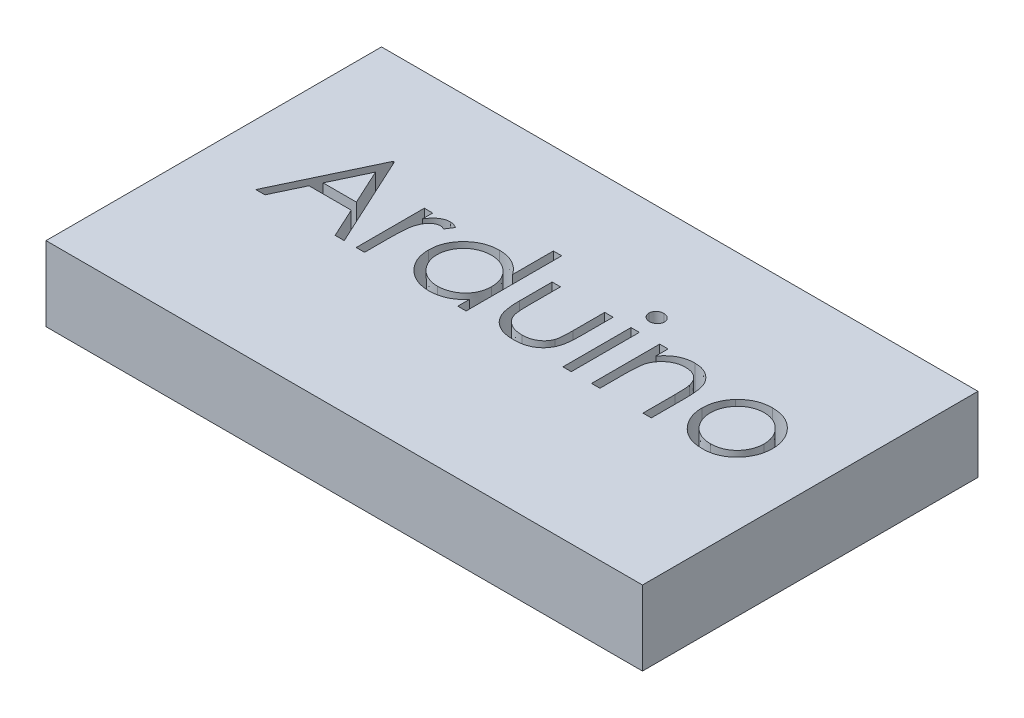
from build123d import *

# Parameters (mm, degrees)
SKETCH1_W           = 101.6
SKETCH1_H           = 57.15
BOSS_EXTRUDE1_DEPTH = 12.7
SKETCH2_W           = 1.424679487
SKETCH2_H           = 11.600961538
CUT_EXTRUDE1_DEPTH  = 118.260276735


with BuildPart() as part:
    # Sketch1 → Boss-Extrude1 (new body)
    with BuildSketch(Plane(origin=(0, 0, 0), x_dir=(1, 0, 0), z_dir=(0, 1, 0))):
        with Locations((50.8, 28.575)):
            Rectangle(SKETCH1_W, SKETCH1_H)
    extrude(amount=BOSS_EXTRUDE1_DEPTH)

    # Sketch2 → Cut-Extrude1 (cut, through all)
    # profile 1 of 8: a face of its own
    with BuildSketch(Plane(origin=(0, 12.7, 0), x_dir=(1, 0, 0), z_dir=(0, 1, 0))):
        Polygon((18.073076923, 41.275), (25.4, 25.4), (23.851297075, 25.4), (21.504392027, 30.488141026), (14.307852564, 30.488141026), (11.894165665, 25.4), (10.339102564, 25.4), (17.869551282, 41.275), align=None)
        Polygon((17.955413662, 38.180774239), (15.080613982, 32.116346154), (20.753891226, 32.116346154), align=None, mode=Mode.SUBTRACT)
    # profile 2 of 8: a face of its own
    with BuildSketch(Plane(origin=(0, 12.7, 0), x_dir=(1, 0, 0), z_dir=(0, 1, 0))):
        with BuildLine():
            Line((27.43525641, 37.000961538), (28.859935897, 37.000961538))
            Line((28.859935897, 37.000961538), (28.859935897, 35.293254207))
            add(Edge.make_bspline(
                [(28.859935897, 35.293254207), (28.965113482, 35.452257428), (29.166264795, 35.756349853), (29.500605581, 36.158528469), (29.84306712, 36.491518144), (30.195288862, 36.75687339), (30.559860958, 36.955597179), (30.928782132, 37.101162017), (31.307856584, 37.187237696), (31.562591027, 37.19872965), (31.690214343, 37.204487179)],
                knots=[0, 0, 0, 0, 1.2804753, 2.448899062, 3.506932113, 4.484331642, 5.4025378, 6.288909075, 7.142734305, 8, 8, 8, 8], degree=3))
            add(Edge.make_bspline(
                [(31.690214343, 37.204487179), (31.789212324, 37.199087291), (31.992907103, 37.18797667), (32.301256707, 37.109913286), (32.618953792, 36.985280827), (32.823706763, 36.86807696), (32.930448718, 36.806976162)],
                knots=[0, 0, 0, 0, 0.901110191, 1.854092781, 2.881294221, 4, 4, 4, 4], degree=3))
            Line((32.930448718, 36.806976162), (32.148147035, 35.573101963))
            add(Edge.make_bspline(
                [(32.148147035, 35.573101963), (32.079616832, 35.603673884), (31.949533388, 35.661705244), (31.759239462, 35.730385075), (31.583791971, 35.770825122), (31.472015831, 35.776951591), (31.419906851, 35.779807692)],
                knots=[0, 0, 0, 0, 1.180555205, 2.24091978, 3.179933427, 4, 4, 4, 4], degree=3))
            add(Edge.make_bspline(
                [(31.419906851, 35.779807692), (31.305580845, 35.772187523), (31.072388934, 35.756644586), (30.730012811, 35.634457851), (30.397784415, 35.437039797), (30.133934375, 35.218095826), (29.929635585, 35.006968316), (29.783856705, 34.822598776), (29.650131389, 34.615867125), (29.522359318, 34.390307488), (29.40594434, 34.142068544), (29.297292805, 33.873630397), (29.199054391, 33.584682134), (29.143037212, 33.383375703), (29.114342949, 33.280258413)],
                knots=[0, 0, 0, 0, 1.125678352, 2.296057538, 3.5422874, 4.923748041, 5.663163013, 6.437101912, 7.23742474, 8.08941207, 8.991984279, 9.93940061, 10.944477711, 12, 12, 12, 12], degree=3))
            add(Edge.make_bspline(
                [(29.114342949, 33.280258413), (29.092878165, 33.188286948), (29.045335299, 32.984577139), (28.999109395, 32.642817759), (28.953436938, 32.239031879), (28.921248705, 31.772095547), (28.891412585, 31.243174819), (28.874584712, 30.651463923), (28.860509754, 29.996355509), (28.860132986, 29.538364692), (28.859935897, 29.298788061)],
                knots=[0, 0, 0, 0, 0.566838948, 1.255505196, 2.06880316, 3.007127437, 4.065329342, 5.249902469, 6.561414163, 8, 8, 8, 8], degree=3))
            Line((28.859935897, 29.298788061), (28.859935897, 25.4))
            Line((28.859935897, 25.4), (27.43525641, 25.4))
            Line((27.43525641, 25.4), (27.43525641, 37.000961538))
        make_face()
    # profile 3 of 8: a face of its own
    with BuildSketch(Plane(origin=(0, 12.7, 0), x_dir=(1, 0, 0), z_dir=(0, 1, 0))):
        with BuildLine():
            Line((46.159615385, 41.682051282), (46.159615385, 25.4))
            Line((46.159615385, 25.4), (44.734935897, 25.4))
            Line((44.734935897, 25.4), (44.734935897, 27.406635617))
            add(Edge.make_bspline(
                [(44.734935897, 27.406635617), (44.574286383, 27.225027459), (44.260776835, 26.870616854), (43.737168907, 26.407601286), (43.182141814, 26.024885328), (42.598389394, 25.715776781), (41.98643879, 25.48358424), (41.347646537, 25.318547018), (40.681752059, 25.212439266), (40.227036021, 25.201843738), (39.996604567, 25.196474359)],
                knots=[0, 0, 0, 0, 1.074387032, 2.096679803, 3.090159297, 4.057316773, 5.018401886, 5.985159533, 6.978961417, 8, 8, 8, 8], degree=3))
            add(Edge.make_bspline(
                [(39.996604567, 25.196474359), (39.791735634, 25.202036833), (39.387725026, 25.213006279), (38.793414569, 25.298106727), (38.221496152, 25.434770618), (37.67142934, 25.624821081), (37.146773538, 25.876919808), (36.643036671, 26.178731897), (36.162828389, 26.538145662), (35.713468194, 26.949027077), (35.299665907, 27.395318626), (34.936530849, 27.871321642), (34.633757951, 28.374977806), (34.380574013, 28.899910325), (34.18555488, 29.450160139), (34.049603039, 30.023824436), (33.964601727, 30.620224934), (33.953636816, 31.026350628), (33.948076923, 31.232281651)],
                knots=[0, 0, 0, 0, 1.033919861, 2.038935746, 3.024066025, 3.998881131, 4.97069526, 5.957263378, 6.95902576, 7.993208707, 9.027059324, 10.027763471, 11.009749337, 11.988697705, 12.965288445, 13.950418724, 14.960734635, 16, 16, 16, 16], degree=3))
            add(Edge.make_bspline(
                [(33.948076923, 31.232281651), (33.953760043, 31.433956306), (33.964995265, 31.83265622), (34.048693798, 32.419027458), (34.189441587, 32.983806712), (34.386962182, 33.525175704), (34.640245335, 34.043789503), (34.94834773, 34.540014902), (35.311291617, 35.015218955), (35.729722177, 35.458227734), (36.182997742, 35.867442663), (36.6679052, 36.22308369), (37.172382226, 36.530227969), (37.704253738, 36.773584808), (38.255647392, 36.970476104), (38.831471949, 37.106697066), (39.42933161, 37.186967059), (39.835234913, 37.198591025), (40.041125801, 37.204487179)],
                knots=[0, 0, 0, 0, 1.020392517, 2.01726096, 2.990465484, 3.961182959, 4.928053699, 5.906110375, 6.912531644, 7.948652711, 8.985773172, 9.998621852, 10.987621588, 11.969261332, 12.953316658, 13.946091881, 14.958173133, 16, 16, 16, 16], degree=3))
            add(Edge.make_bspline(
                [(40.041125801, 37.204487179), (40.277966322, 37.19737928), (40.742857944, 37.183427262), (41.422754809, 37.066830526), (42.0658629, 36.871056045), (42.675884665, 36.603034876), (43.249183349, 36.254688611), (43.789961325, 35.833994544), (44.288814254, 35.329046417), (44.583961449, 34.949808209), (44.734935897, 34.755819311)],
                knots=[0, 0, 0, 0, 1.031072012, 2.023879775, 2.993683497, 3.952812103, 4.918022106, 5.908088563, 6.929940113, 8, 8, 8, 8], degree=3))
            Line((44.734935897, 34.755819311), (44.734935897, 41.682051282))
            Line((44.734935897, 41.682051282), (46.159615385, 41.682051282))
        make_face()
        with BuildLine():
            add(Edge.make_bspline(
                [(40.06020633, 35.779807692), (39.851952012, 35.772397978), (39.440891112, 35.757772381), (38.837441531, 35.6435926), (38.25998426, 35.453616047), (37.711407423, 35.193801709), (37.200376584, 34.86709994), (36.743658862, 34.471942237), (36.337518753, 34.019110065), (35.995941983, 33.510646922), (35.717492229, 32.965553437), (35.521698905, 32.395756879), (35.392570533, 31.811534302), (35.379378315, 31.41528212), (35.37275641, 31.21638121)],
                knots=[0, 0, 0, 0, 1.031046209, 2.035121221, 3.029706178, 4.034933723, 5.034054252, 6.02443088, 7.017295772, 8.038157696, 9.050218397, 10.03989886, 11.016116709, 12, 12, 12, 12], degree=3))
            add(Edge.make_bspline(
                [(35.37275641, 31.21638121), (35.381215033, 31.018668938), (35.398099125, 30.62401936), (35.519432632, 30.039000315), (35.722994915, 29.469069481), (36.000771414, 28.919064261), (36.348600033, 28.408414948), (36.751773564, 27.946950821), (37.214190912, 27.550123046), (37.726397819, 27.217938337), (38.273441113, 26.949594046), (38.848723588, 26.762878466), (39.441430947, 26.642329247), (39.844439747, 26.628248227), (40.047485978, 26.621153846)],
                knots=[0, 0, 0, 0, 0.979072187, 1.954306742, 2.945804271, 3.96968567, 4.997920485, 5.998718438, 6.996577872, 8.005894225, 9.015743152, 10.005417472, 10.995077863, 12, 12, 12, 12], degree=3))
            add(Edge.make_bspline(
                [(40.047485978, 26.621153846), (40.253618329, 26.628682968), (40.663595133, 26.643657645), (41.268834986, 26.758326241), (41.856187139, 26.947777577), (42.417650639, 27.210391473), (42.940691662, 27.535862337), (43.410128464, 27.9168945), (43.807075892, 28.360048228), (44.143592372, 28.84707714), (44.40745944, 29.380985124), (44.599665137, 29.949465204), (44.713302496, 30.552537168), (44.727625055, 30.96466998), (44.734935897, 31.175040064)],
                knots=[0, 0, 0, 0, 1.01762866, 2.023962475, 3.030623092, 4.058876274, 5.077231937, 6.066672613, 7.034107872, 8.005628644, 8.981990164, 9.965428785, 10.961468474, 12, 12, 12, 12], degree=3))
            add(Edge.make_bspline(
                [(44.734935897, 31.175040064), (44.73058317, 31.335322367), (44.722015626, 31.650808661), (44.656562686, 32.114029901), (44.552445698, 32.557322159), (44.405732712, 32.981151498), (44.213004387, 33.383174604), (43.980559163, 33.766278088), (43.704309444, 34.128469439), (43.388702216, 34.464761226), (43.043238618, 34.771495537), (42.677684809, 35.045290485), (42.287709778, 35.27021099), (41.879871789, 35.456362472), (41.453463237, 35.604495045), (41.005014354, 35.703317798), (40.539291806, 35.77117354), (40.221582912, 35.776899339), (40.06020633, 35.779807692)],
                knots=[0, 0, 0, 0, 1.050140795, 2.067009409, 3.05949893, 4.030605086, 5.00011959, 5.97591094, 6.962425594, 7.979863591, 8.993523472, 9.986985069, 10.967611495, 11.937549037, 12.921786183, 13.919465291, 14.943216303, 16, 16, 16, 16], degree=3))
        make_face(mode=Mode.SUBTRACT)
    # profile 4 of 8: a face of its own
    with BuildSketch(Plane(origin=(0, 12.7, 0), x_dir=(1, 0, 0), z_dir=(0, 1, 0))):
        with BuildLine():
            Line((49.2125, 37.000961538), (50.637179487, 37.000961538))
            Line((50.637179487, 37.000961538), (50.637179487, 31.620252404))
            add(Edge.make_bspline(
                [(50.637179487, 31.620252404), (50.637823127, 31.462306363), (50.639054381, 31.160162985), (50.647404363, 30.725391245), (50.66704443, 30.328894013), (50.691599991, 29.970442242), (50.723178252, 29.650096573), (50.760749208, 29.368975918), (50.802742763, 29.123892298), (50.843848645, 28.976284934), (50.862965745, 28.90763722)],
                knots=[0, 0, 0, 0, 1.388932606, 2.656963016, 3.823490214, 4.879454478, 5.816252168, 6.653371382, 7.373723809, 8, 8, 8, 8], degree=3))
            add(Edge.make_bspline(
                [(50.862965745, 28.90763722), (50.893633773, 28.821354912), (50.954332249, 28.650584085), (51.064429836, 28.403891097), (51.200629791, 28.175403209), (51.349672582, 27.956309736), (51.521573466, 27.753100724), (51.714157496, 27.566119333), (51.920978071, 27.388300777), (52.228295498, 27.177912613), (52.648571455, 26.95241808), (53.200353595, 26.757854904), (53.798633477, 26.641578149), (54.212130596, 26.628087778), (54.424664463, 26.621153846)],
                knots=[0, 0, 0, 0, 0.725840625, 1.436591201, 2.137033971, 2.831655856, 3.53531722, 4.242432219, 4.957935707, 5.694543706, 7.190802206, 8.724350549, 10.316345118, 12, 12, 12, 12], degree=3))
            add(Edge.make_bspline(
                [(54.424664463, 26.621153846), (54.637178587, 26.628235224), (55.048354097, 26.641936379), (55.640060565, 26.754347429), (56.180950909, 26.942151804), (56.665596295, 27.204349708), (57.091798499, 27.525215493), (57.44696497, 27.901719732), (57.740005017, 28.32195088), (57.867954889, 28.635478859), (57.932301683, 28.793154046)],
                knots=[0, 0, 0, 0, 1.157059328, 2.238695713, 3.266970494, 4.264342957, 5.228770407, 6.160125903, 7.074715775, 8, 8, 8, 8], degree=3))
            add(Edge.make_bspline(
                [(57.932301683, 28.793154046), (57.951325512, 28.856501187), (57.993382552, 28.996546243), (58.038568932, 29.234125816), (58.079274526, 29.517447415), (58.114032504, 29.848365005), (58.13882092, 30.226013803), (58.152183255, 30.650275792), (58.16727936, 31.119819104), (58.167508487, 31.448512155), (58.167628205, 31.620252404)],
                knots=[0, 0, 0, 0, 0.557542046, 1.232589297, 2.036731608, 2.971723315, 4.038036528, 5.22795436, 6.551621927, 8, 8, 8, 8], degree=3))
            Line((58.167628205, 31.620252404), (58.167628205, 37.000961538))
            Line((58.167628205, 37.000961538), (59.592307692, 37.000961538))
            Line((59.592307692, 37.000961538), (59.592307692, 31.353125))
            add(Edge.make_bspline(
                [(59.592307692, 31.353125), (59.590304291, 31.161231758), (59.586417418, 30.788932619), (59.561437681, 30.247893971), (59.518576938, 29.743693789), (59.453522617, 29.276065184), (59.377024736, 28.845365178), (59.278344498, 28.451041762), (59.160514634, 28.094309857), (59.027593191, 27.768909654), (58.870558292, 27.473875527), (58.703521448, 27.193859502), (58.510641233, 26.935809403), (58.307576242, 26.686879709), (58.08169016, 26.459452067), (57.8372158, 26.248307873), (57.577594146, 26.050219479), (57.297063855, 25.872912604), (56.999720284, 25.713179963), (56.685196361, 25.571592752), (56.34963969, 25.45954892), (55.997379623, 25.362889829), (55.626690302, 25.287077772), (55.237929091, 25.233617273), (54.831226939, 25.200845237), (54.55405189, 25.197955783), (54.411944111, 25.196474359)],
                knots=[0, 0, 0, 0, 1.493040784, 2.896703357, 4.213163133, 5.428574705, 6.569057535, 7.615249723, 8.588095153, 9.490268104, 10.346124644, 11.18633936, 12.024365274, 12.850166724, 13.684164916, 14.514361689, 15.362232829, 16.222528818, 17.093394965, 17.986930858, 18.902426812, 19.842810585, 20.827885679, 21.843828298, 22.894529745, 24, 24, 24, 24], degree=3))
            add(Edge.make_bspline(
                [(54.411944111, 25.196474359), (54.270899207, 25.198015174), (53.993732842, 25.201043018), (53.587009699, 25.233436217), (53.197171377, 25.286994705), (52.825603855, 25.363445155), (52.471934268, 25.458872365), (52.134730037, 25.572281258), (51.81793959, 25.713253444), (51.517756929, 25.871901651), (51.236531811, 26.051358436), (50.972967903, 26.248063472), (50.727418608, 26.461723116), (50.499829764, 26.691445057), (50.293395906, 26.940079018), (50.105544574, 27.205624952), (49.933383804, 27.485451711), (49.777569362, 27.785095341), (49.643712471, 28.114261243), (49.52553332, 28.478465933), (49.428874353, 28.881702349), (49.350213871, 29.323625738), (49.286934123, 29.802121106), (49.243000549, 30.319956418), (49.218435888, 30.875870307), (49.214521288, 31.259818023), (49.2125, 31.458067909)],
                knots=[0, 0, 0, 0, 1.083640291, 2.129454052, 3.13281866, 4.105697902, 5.042300162, 5.946461698, 6.836384745, 7.703652036, 8.553297018, 9.397182691, 10.228592656, 11.052265423, 11.879314572, 12.708807002, 13.549817954, 14.402308542, 15.300838682, 16.27712199, 17.341985831, 18.484375296, 19.725102775, 21.0496083, 22.476576903, 24, 24, 24, 24], degree=3))
            Line((49.2125, 31.458067909), (49.2125, 37.000961538))
        make_face()
    # profile 5 of 8: a face of its own
    with BuildSketch(Plane(origin=(0, 12.7, 0), x_dir=(1, 0, 0), z_dir=(0, 1, 0))):
        with BuildLine():
            add(Edge.make_bspline(
                [(63.351171875, 41.885576923), (63.439578914, 41.881475946), (63.612696877, 41.873445446), (63.86303777, 41.804677317), (64.090989218, 41.688110887), (64.293181078, 41.531720906), (64.466680706, 41.347800216), (64.588150357, 41.133437967), (64.666220868, 40.901850569), (64.675648601, 40.740310701), (64.680448718, 40.658062901)],
                knots=[0, 0, 0, 0, 1.055194115, 2.066272739, 3.074728998, 4.095836921, 5.109056067, 6.073838105, 7.019297344, 8, 8, 8, 8], degree=3))
            add(Edge.make_bspline(
                [(64.680448718, 40.658062901), (64.67554035, 40.577950152), (64.665837088, 40.41957673), (64.588210659, 40.192004196), (64.465645509, 39.980620482), (64.293292332, 39.797056903), (64.090959737, 39.640753377), (63.863045602, 39.524164025), (63.612694817, 39.455401974), (63.439578218, 39.447370636), (63.351171875, 39.443269231)],
                knots=[0, 0, 0, 0, 0.96129708, 1.900370562, 2.859976407, 3.87933698, 4.906634145, 5.921202961, 6.938410037, 8, 8, 8, 8], degree=3))
            add(Edge.make_bspline(
                [(63.351171875, 39.443269231), (63.263776484, 39.447214033), (63.093672774, 39.454892076), (62.847080311, 39.525513228), (62.621072519, 39.640793273), (62.418486326, 39.79603347), (62.249620807, 39.981747825), (62.126710545, 40.191875194), (62.049263397, 40.419609574), (62.039535974, 40.577961185), (62.034615385, 40.658062901)],
                knots=[0, 0, 0, 0, 1.054934014, 2.053291228, 3.073705704, 4.106921865, 5.123545215, 6.088680038, 7.033164197, 8, 8, 8, 8], degree=3))
            add(Edge.make_bspline(
                [(62.034615385, 40.658062901), (62.03942817, 40.740299254), (62.048880785, 40.901816641), (62.126768598, 41.133569112), (62.248597011, 41.346663781), (62.418598139, 41.532743725), (62.621042762, 41.688071233), (62.847087999, 41.803328184), (63.093670743, 41.873955331), (63.263775795, 41.881632546), (63.351171875, 41.885576923)],
                knots=[0, 0, 0, 0, 0.98631895, 1.937192651, 2.907499808, 3.917963147, 4.944918757, 5.95915025, 6.951458133, 8, 8, 8, 8], degree=3))
        make_face()
    # profile 6 of 8: a face of its own
    with BuildSketch(Plane(origin=(0, 12.7, 0), x_dir=(1, 0, 0), z_dir=(0, 1, 0))):
        with Locations((63.357532052, 31.200480769)):
            Rectangle(SKETCH2_W, SKETCH2_H)
    # profile 7 of 8: a face of its own
    with BuildSketch(Plane(origin=(0, 12.7, 0), x_dir=(1, 0, 0), z_dir=(0, 1, 0))):
        with BuildLine():
            Line((67.529807692, 37.000961538), (68.954487179, 37.000961538))
            Line((68.954487179, 37.000961538), (68.954487179, 34.908463542))
            add(Edge.make_bspline(
                [(68.954487179, 34.908463542), (69.10660431, 35.098250177), (69.40179291, 35.466537765), (69.893393278, 35.9505918), (70.412931683, 36.349486214), (70.957226485, 36.667456993), (71.527016567, 36.90715419), (72.11882872, 37.080263949), (72.736206136, 37.184062993), (73.156051975, 37.197625823), (73.368449519, 37.204487179)],
                knots=[0, 0, 0, 0, 1.12780773, 2.188550248, 3.19190651, 4.159438251, 5.104880172, 6.052711206, 7.014878035, 8, 8, 8, 8], degree=3))
            add(Edge.make_bspline(
                [(73.368449519, 37.204487179), (73.583127753, 37.196571472), (74.003304838, 37.181078522), (74.615073188, 37.05853853), (75.18645251, 36.849236837), (75.715405495, 36.562524946), (76.192232498, 36.205988442), (76.610991646, 35.790617789), (76.957353518, 35.312843412), (77.189570129, 34.869599096), (77.342540031, 34.476403493), (77.438843847, 34.139641448), (77.520627228, 33.764455548), (77.59152837, 33.351979555), (77.639503128, 32.899323478), (77.677341379, 32.408342874), (77.704459028, 31.879196783), (77.705534931, 31.513225294), (77.706089744, 31.324504207)],
                knots=[0, 0, 0, 0, 1.235846778, 2.418850247, 3.575807741, 4.728682307, 5.871620074, 6.994088408, 8.11269785, 9.256955736, 9.865816715, 10.540099792, 11.271859618, 12.076849838, 12.949306005, 13.892391288, 14.913166135, 16, 16, 16, 16], degree=3))
            Line((77.706089744, 31.324504207), (77.706089744, 25.4))
            Line((77.706089744, 25.4), (76.281410256, 25.4))
            Line((76.281410256, 25.4), (76.281410256, 30.85703125))
            add(Edge.make_bspline(
                [(76.281410256, 30.85703125), (76.28053392, 31.014975911), (76.278857638, 31.317097167), (76.273570597, 31.749663808), (76.260826117, 32.141942217), (76.242917698, 32.492994562), (76.216705667, 32.802483749), (76.189388732, 33.071040112), (76.155983301, 33.298322679), (76.126215802, 33.435142874), (76.112865585, 33.496504407)],
                knots=[0, 0, 0, 0, 1.430800155, 2.736877192, 3.918605307, 4.986035426, 5.920637409, 6.731861385, 7.431261377, 8, 8, 8, 8], degree=3))
            add(Edge.make_bspline(
                [(76.112865585, 33.496504407), (76.06467121, 33.676622996), (75.971911949, 34.023295552), (75.74270424, 34.493532794), (75.453261348, 34.893574575), (75.09993896, 35.220947562), (74.686149939, 35.475722429), (74.213042541, 35.652497152), (73.685182278, 35.763060944), (73.313914185, 35.774069722), (73.120402644, 35.779807692)],
                knots=[0, 0, 0, 0, 1.084156227, 2.086665306, 3.027808233, 3.945421172, 4.874247719, 5.839848303, 6.874090471, 8, 8, 8, 8], degree=3))
            add(Edge.make_bspline(
                [(73.120402644, 35.779807692), (73.005795651, 35.777648671), (72.778991372, 35.773376024), (72.442668285, 35.730507637), (72.116440785, 35.660392499), (71.797034837, 35.565738321), (71.490838773, 35.435734458), (71.188015023, 35.288190528), (70.899966486, 35.104275424), (70.620551078, 34.899303677), (70.360596557, 34.672158701), (70.118714451, 34.432471102), (69.903095573, 34.177221041), (69.707748368, 33.910521279), (69.539118387, 33.628709014), (69.391920452, 33.334503053), (69.267026408, 33.027516163), (69.204965624, 32.814450707), (69.173913261, 32.707842548)],
                knots=[0, 0, 0, 0, 1.023777757, 2.026029729, 3.023749952, 4.003683103, 4.997618607, 5.993177895, 7.010360494, 8.046726602, 9.087585522, 10.09234134, 11.086953743, 12.070360549, 13.043493632, 14.017870808, 15.008233677, 16, 16, 16, 16], degree=3))
            add(Edge.make_bspline(
                [(69.173913261, 32.707842548), (69.156044141, 32.629577877), (69.117144001, 32.459199782), (69.075128863, 32.179598309), (69.036994504, 31.856156637), (69.00507687, 31.489252198), (68.985548731, 31.077600408), (68.964256288, 30.622959286), (68.956504476, 30.123515964), (68.955178441, 29.775800429), (68.954487179, 29.594536258)],
                knots=[0, 0, 0, 0, 0.615963638, 1.340920617, 2.168419149, 3.115676021, 4.16674242, 5.331190069, 6.6087489, 8, 8, 8, 8], degree=3))
            Line((68.954487179, 29.594536258), (68.954487179, 25.4))
            Line((68.954487179, 25.4), (67.529807692, 25.4))
            Line((67.529807692, 25.4), (67.529807692, 37.000961538))
        make_face()
    # profile 8 of 8: a face of its own
    with BuildSketch(Plane(origin=(0, 12.7, 0), x_dir=(1, 0, 0), z_dir=(0, 1, 0))):
        with BuildLine():
            add(Edge.make_bspline(
                [(86.565815304, 37.204487179), (86.783490006, 37.199852173), (87.2102969, 37.190764059), (87.835354096, 37.093631893), (88.432005249, 36.945099205), (89.002535477, 36.739760334), (89.53963796, 36.464524344), (90.051136103, 36.136096488), (90.535627536, 35.747011153), (90.826017705, 35.446029914), (90.973417468, 35.293254207)],
                knots=[0, 0, 0, 0, 1.054011418, 2.066658804, 3.057071809, 4.030435133, 4.997543892, 5.974964718, 6.972108034, 8, 8, 8, 8], degree=3))
            add(Edge.make_bspline(
                [(90.973417468, 35.293254207), (91.100335617, 35.147140771), (91.351715699, 34.857741598), (91.674049494, 34.388496496), (91.951732999, 33.902539611), (92.174268573, 33.393417808), (92.349732787, 32.86557555), (92.474309338, 32.31719857), (92.548409007, 31.749497924), (92.558401036, 31.363944802), (92.563461538, 31.168679888)],
                knots=[0, 0, 0, 0, 1.025258237, 2.030674902, 3.01204498, 3.988269485, 4.97094183, 5.956517959, 6.965070386, 8, 8, 8, 8], degree=3))
            add(Edge.make_bspline(
                [(92.563461538, 31.168679888), (92.559010473, 30.972283198), (92.550214959, 30.584194179), (92.467013556, 30.012606341), (92.337604703, 29.458365538), (92.152403151, 28.923792177), (91.914921727, 28.40725221), (91.625131823, 27.911001754), (91.280999845, 27.434061721), (90.890910288, 26.980481955), (90.459782136, 26.562442338), (89.992076749, 26.198096258), (89.496985238, 25.885941487), (88.967924315, 25.634497744), (88.409725356, 25.436243032), (87.821184369, 25.296996529), (87.203215657, 25.212806035), (86.78127076, 25.201994828), (86.565815304, 25.196474359)],
                knots=[0, 0, 0, 0, 0.998656419, 1.973391657, 2.932242238, 3.890759089, 4.846373663, 5.82037756, 6.809684879, 7.83454468, 8.860553229, 9.859544525, 10.845671541, 11.83227036, 12.833544569, 13.85385346, 14.904124723, 16, 16, 16, 16], degree=3))
            add(Edge.make_bspline(
                [(86.565815304, 25.196474359), (86.349304255, 25.202013356), (85.925256427, 25.212861762), (85.305106438, 25.296669437), (84.715510666, 25.436178858), (84.156580952, 25.635149271), (83.625245396, 25.885949523), (83.127285213, 26.197152544), (82.659199882, 26.562550391), (82.227980524, 26.980452677), (81.837915421, 27.434069265), (81.493777133, 27.910999796), (81.203988868, 28.40725272), (80.966507015, 28.923792041), (80.781305578, 29.458365575), (80.651896693, 30.012606331), (80.568695299, 30.584194181), (80.559899784, 30.972283199), (80.555448718, 31.168679888)],
                knots=[0, 0, 0, 0, 1.099876186, 2.154163076, 3.173186993, 4.173200201, 5.163417411, 6.152872554, 7.150605724, 8.17532212, 9.198891216, 10.186952605, 11.159729845, 12.11414092, 13.071450619, 14.029093627, 15.002601286, 16, 16, 16, 16], degree=3))
            add(Edge.make_bspline(
                [(80.555448718, 31.168679888), (80.560543733, 31.362883507), (80.570630986, 31.747373296), (80.644656153, 32.31400675), (80.768746748, 32.861455622), (80.944421296, 33.387260459), (81.169008055, 33.894151187), (81.442789611, 34.381308813), (81.768411409, 34.848432051), (82.018791689, 35.1374572), (82.145492788, 35.283713942)],
                knots=[0, 0, 0, 0, 1.031353054, 2.041901799, 3.029428768, 4.008703097, 4.981709435, 5.96992636, 6.972712378, 8, 8, 8, 8], degree=3))
            add(Edge.make_bspline(
                [(82.145492788, 35.283713942), (82.292670326, 35.43781456), (82.582120852, 35.740880539), (83.06902401, 36.12883163), (83.579263841, 36.464093822), (84.122301899, 36.733860943), (84.692363433, 36.946307076), (85.29207214, 37.094014949), (85.919250371, 37.190414094), (86.348145795, 37.199749401), (86.565815304, 37.204487179)],
                knots=[0, 0, 0, 0, 1.027980169, 2.021703884, 2.998553061, 3.971491411, 4.943284454, 5.930300938, 6.949603206, 8, 8, 8, 8], degree=3))
        make_face()
        with BuildLine():
            add(Edge.make_bspline(
                [(86.559455128, 35.779807692), (86.40552382, 35.77543258), (86.101634915, 35.766795298), (85.654324655, 35.701100445), (85.223703243, 35.597017123), (84.8089537, 35.449134439), (84.411474668, 35.258185862), (84.030885593, 35.023651514), (83.666067026, 34.748637747), (83.324155524, 34.433574915), (83.010364323, 34.089409476), (82.7360535, 33.722704419), (82.502803911, 33.339407777), (82.30849319, 32.939120962), (82.163771301, 32.517787514), (82.058665092, 32.080178936), (81.993032215, 31.625403654), (81.984476141, 31.31624475), (81.980128205, 31.159139623)],
                knots=[0, 0, 0, 0, 1.021534396, 2.016698045, 2.994645724, 3.958388632, 4.93408049, 5.916473867, 6.921342795, 7.962252576, 8.998418191, 10.008913653, 10.997312074, 11.973003931, 12.956656626, 13.948281152, 14.957379055, 16, 16, 16, 16], degree=3))
            add(Edge.make_bspline(
                [(81.980128205, 31.159139623), (81.987416298, 30.956157214), (82.0018818, 30.553275089), (82.119516622, 29.959953212), (82.316304392, 29.390349811), (82.582039553, 28.84780406), (82.914989188, 28.345826228), (83.307269812, 27.898280566), (83.75467131, 27.511902065), (84.251860436, 27.191313944), (84.788681806, 26.936589337), (85.356808691, 26.756072555), (85.949357553, 26.63872595), (86.354309441, 26.627062477), (86.559455128, 26.621153846)],
                knots=[0, 0, 0, 0, 1.016792936, 2.018143844, 3.017858371, 4.030088057, 5.03801393, 6.028138512, 7.003788237, 7.991172063, 8.984598303, 9.972568034, 10.972917682, 12, 12, 12, 12], degree=3))
            add(Edge.make_bspline(
                [(86.559455128, 26.621153846), (86.764589016, 26.627096903), (87.169517612, 26.638828332), (87.761243164, 26.75548155), (88.327817251, 26.937380297), (88.864081044, 27.191027463), (89.361043852, 27.513119488), (89.811663081, 27.896098769), (90.200594282, 28.347011595), (90.533214561, 28.848468958), (90.803301573, 29.389508698), (90.999168238, 29.96005834), (91.11708586, 30.553248316), (91.13151319, 30.956148245), (91.138782051, 31.159139623)],
                knots=[0, 0, 0, 0, 1.02726834, 2.027799167, 3.010890988, 4.004497153, 4.992059811, 5.971914811, 6.958719428, 7.966827853, 8.981595046, 9.981490638, 10.983022906, 12, 12, 12, 12], degree=3))
            add(Edge.make_bspline(
                [(91.138782051, 31.159139623), (91.134435612, 31.316245689), (91.125882484, 31.625406441), (91.060228181, 32.080168284), (90.955201269, 32.517826597), (90.810187148, 32.938976755), (90.616720728, 33.340444185), (90.378973131, 33.721579019), (90.105782408, 34.090679781), (89.788204753, 34.432462366), (89.446650146, 34.748760568), (89.081683723, 35.023758155), (88.701658999, 35.257155106), (88.305334713, 35.450767698), (87.890531995, 35.595671705), (87.460513945, 35.701701427), (87.0151122, 35.766517676), (86.712312254, 35.775349353), (86.559455128, 35.779807692)],
                knots=[0, 0, 0, 0, 1.042956736, 2.052379634, 3.044323526, 4.02829302, 5.004299113, 5.996692471, 7.007513377, 8.048758398, 9.090003419, 10.095195979, 11.07790575, 12.047570684, 13.018257071, 13.989683339, 14.985167495, 16, 16, 16, 16], degree=3))
        make_face(mode=Mode.SUBTRACT)
    extrude(amount=-CUT_EXTRUDE1_DEPTH, mode=Mode.SUBTRACT)


with BuildPart() as cut_extrude1_piece_1:
    # of the separate pieces the step leaves, piece 1, a body of its own (cut_extrude1_pieces)
    add(part.part.solids().sort_by_distance((0, 0, 0))[0])


with BuildPart() as cut_extrude1_piece_2:
    # of the separate pieces the step leaves, piece 2, a body of its own (cut_extrude1_pieces)
    add(part.part.solids().sort_by_distance((35.37275641, 0, -31.21638121))[0])


with BuildPart() as cut_extrude1_piece_3:
    # of the separate pieces the step leaves, piece 3, a body of its own (cut_extrude1_pieces)
    add(part.part.solids().sort_by_distance((81.980128205, 0, -31.159139623))[0])


with BuildPart() as cut_extrude1_piece_4:
    # of the separate pieces the step leaves, piece 4, a body of its own (cut_extrude1_pieces)
    add(part.part.solids().sort_by_distance((20.753891226, 0, -32.116346154))[0])


solid = Compound([cut_extrude1_piece_1.part, cut_extrude1_piece_2.part, cut_extrude1_piece_3.part, cut_extrude1_piece_4.part])
